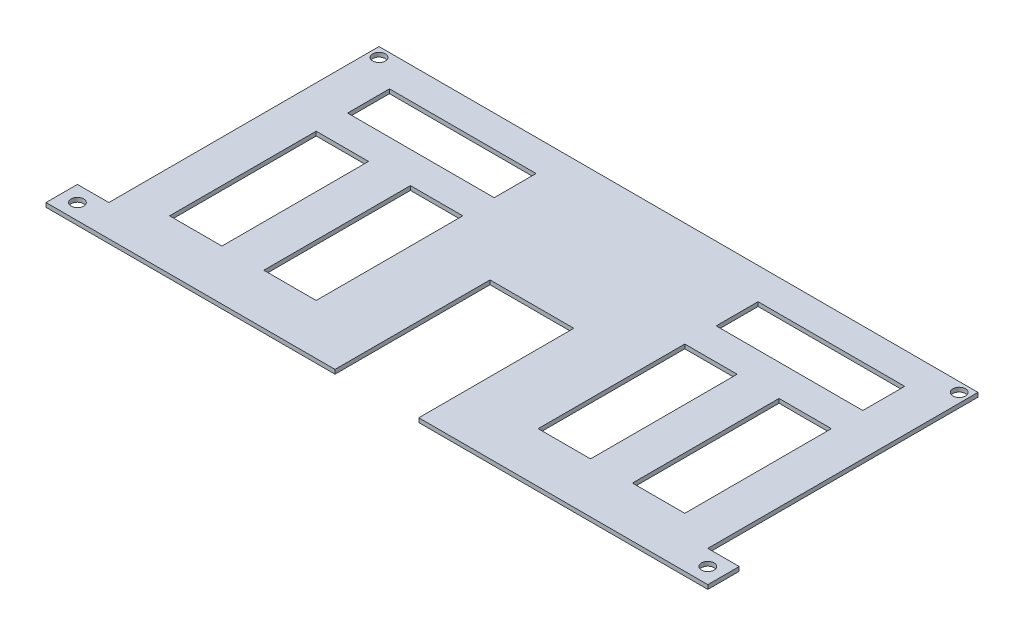
from build123d import *

# Parameters (mm, degrees)
SKETCH_1_R          = 3
EXTRUDE_1_DEPTH     = 2
SKETCH_2_W          = 15
SKETCH_2_H          = 129
CUT_EXTRUDE_1_DEPTH = 174.643312569
SKETCH_3_W          = 40
SKETCH_3_H          = 74
CUT_EXTRUDE_2_DEPTH = 174.643312569
SKETCH_4_W          = 70
SKETCH_4_H          = 20
SKETCH_4_W_2        = 25
SKETCH_4_H_2        = 70
CUT_EXTRUDE_3_DEPTH = 174.643312569


with BuildPart() as part:
    # Эскиз1 → Бобышка-Вытянуть1 (new body)
    with BuildSketch(Plane(origin=(0, 0, 0), x_dir=(1, 0, 0), z_dir=(0, 1, 0))):
        Polygon((-143, 72), (158, 72), (158, -72), (-143, -72), (-158, -72), (-158, 72), align=None)
        with Locations(Location((-138.5, 67.5, 0), (0, 0, 270))):
            Circle(SKETCH_1_R, mode=Mode.SUBTRACT)
        with Locations(Location((-150.5, -64.5, 0), (0, 0, 270))):
            Circle(SKETCH_1_R, mode=Mode.SUBTRACT)
        with Locations(Location((150.5, -64.5, 0), (0, 0, 270))):
            Circle(SKETCH_1_R, mode=Mode.SUBTRACT)
        with Locations(Location((138.5, 67.5, 0), (0, 0, 270))):
            Circle(SKETCH_1_R, mode=Mode.SUBTRACT)
    extrude(amount=EXTRUDE_1_DEPTH)

    # Эскиз2 → Вырез-Вытянуть1 (cut, through all)
    with BuildSketch(Plane(origin=(0, 2, 0), x_dir=(1, 0, 0), z_dir=(0, 1, 0))):
        with Locations((150.5, 7.5)):
            Rectangle(SKETCH_2_W, SKETCH_2_H)
        with Locations((-150.5, 7.5)):
            Rectangle(SKETCH_2_W, SKETCH_2_H)
    extrude(amount=-CUT_EXTRUDE_1_DEPTH, mode=Mode.SUBTRACT)

    # Эскиз3 → Вырез-Вытянуть2 (cut, through all)
    with BuildSketch(Plane(origin=(0, 2, 0), x_dir=(1, 0, 0), z_dir=(0, 1, 0))):
        with Locations((0, -35)):
            Rectangle(SKETCH_3_W, SKETCH_3_H)
    extrude(amount=-CUT_EXTRUDE_2_DEPTH, mode=Mode.SUBTRACT)

    # Эскиз4 → Вырез-Вытянуть3 (cut, through all)
    with BuildSketch(Plane(origin=(0, 2, 0), x_dir=(1, 0, 0), z_dir=(0, 1, 0))):
        with Locations((-88, 47)):
            Rectangle(SKETCH_4_W, SKETCH_4_H)
        with Locations((-110.5, -13)):
            Rectangle(SKETCH_4_W_2, SKETCH_4_H_2)
        with Locations((-65.5, -13)):
            Rectangle(SKETCH_4_W_2, SKETCH_4_H_2)
        with Locations((65.5, -13)):
            Rectangle(SKETCH_4_W_2, SKETCH_4_H_2)
        with Locations((110.5, -13)):
            Rectangle(SKETCH_4_W_2, SKETCH_4_H_2)
        with Locations((88, 47)):
            Rectangle(SKETCH_4_W, SKETCH_4_H)
    extrude(amount=-CUT_EXTRUDE_3_DEPTH, mode=Mode.SUBTRACT)


solid = part.part
